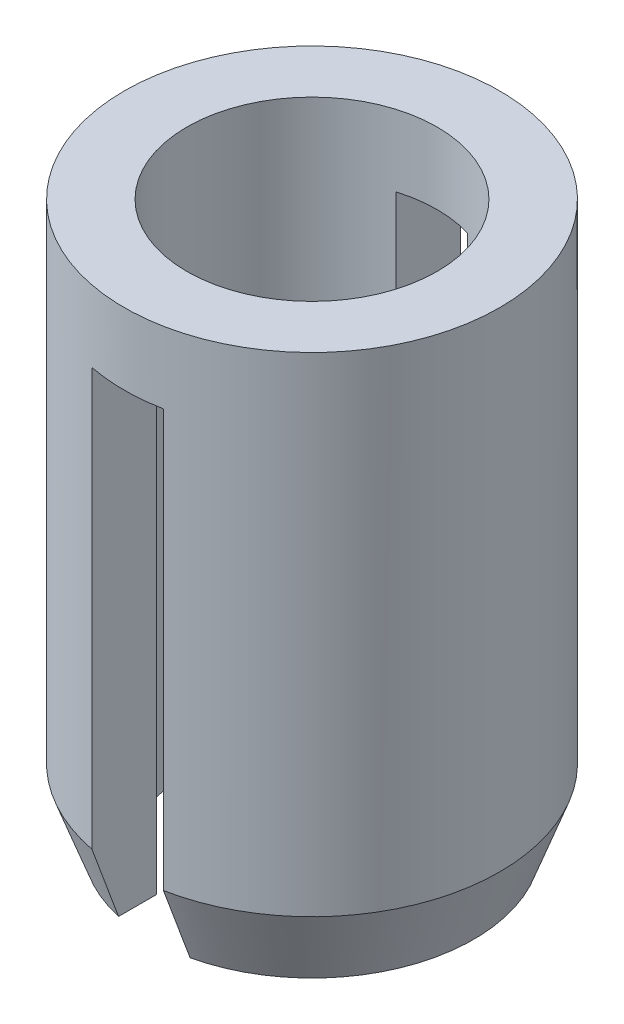
from build123d import *

# Parameters (mm, degrees)
M5_TAPPED_HOLE1_D       = 4.2
CUT_EXTRUDE1_DEPTH      = 11.402163237
CUT_EXTRUDE1_DEPTH_BACK = 11.402163237
SKETCH2_W               = 1.2
SKETCH2_H               = 8.2


with BuildPart() as part:
    # Sketch1 → Revolve1 (revolve)
    with BuildSketch(Plane.XY, mode=Mode.PRIVATE) as revolve1_sk:
        Polygon((0, -9.4), (0, 0), (-3.15, 0), (-3.15, -8.2), (-2.713235719, -9.4), align=None)
    revolve(revolve1_sk.sketch.rotate(Axis((0, -9.4, 0), (0, 1, 0)), 180), axis=Axis((0, -9.4, 0), (0, 1, 0)))

    # M5 Tapped Hole1 (through all)
    with Locations(Plane(origin=(0, 0, 0), x_dir=(1, 0, 0), z_dir=(0, 1, 0))):
        with Locations((0, 0)):
            Hole(M5_TAPPED_HOLE1_D / 2)

    # Sketch2 → Cut-Extrude1 (cut, two sides: drawn at the far end of the back side and taken through both)
    with BuildSketch(Plane.XY.offset(-CUT_EXTRUDE1_DEPTH_BACK)):
        with Locations((0, -5.3)):
            Rectangle(SKETCH2_W, SKETCH2_H)
    extrude(amount=CUT_EXTRUDE1_DEPTH + CUT_EXTRUDE1_DEPTH_BACK, mode=Mode.SUBTRACT)


solid = part.part
